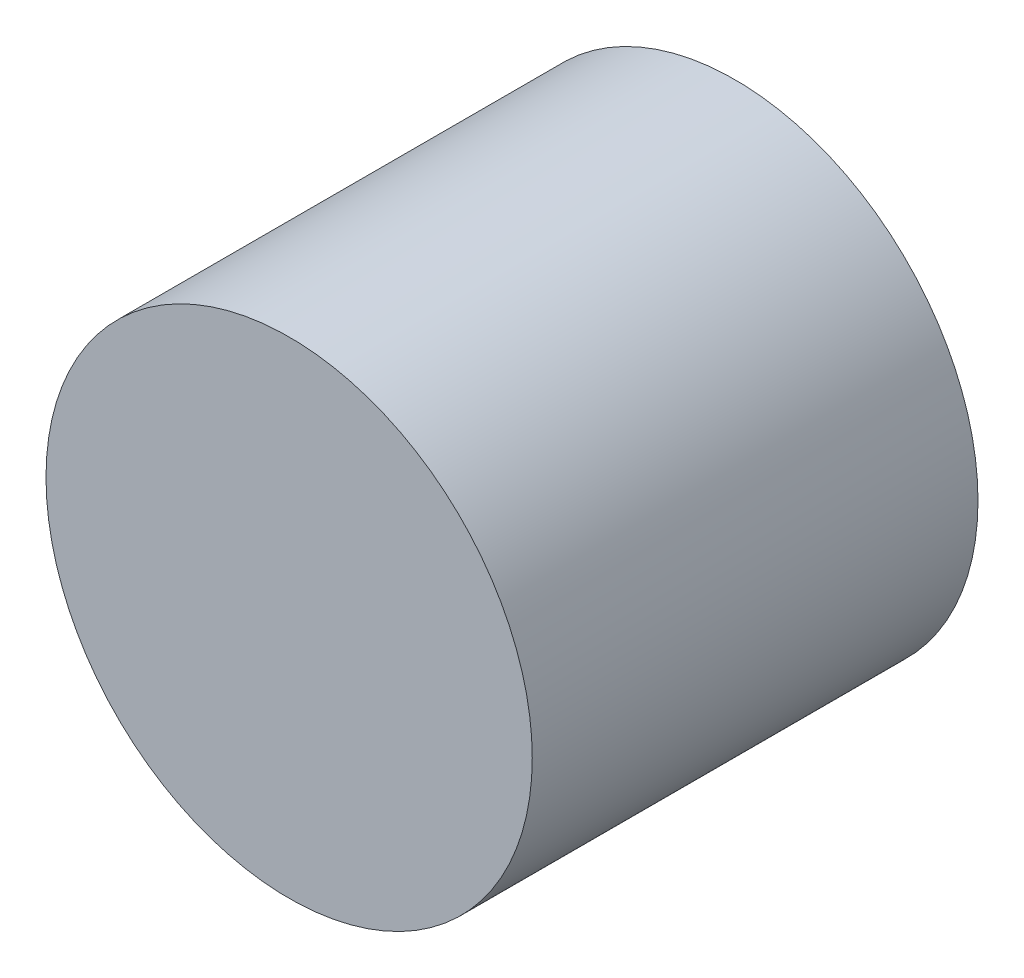
from build123d import *

# Parameters (mm, degrees)
SKETCH1_R           = 6
BOSS_EXTRUDE1_DEPTH = 11


with BuildPart() as part:
    # Sketch1 → Boss-Extrude1 (new body)
    with BuildSketch(Plane.XY):
        Circle(SKETCH1_R)
    extrude(amount=BOSS_EXTRUDE1_DEPTH)


solid = part.part
